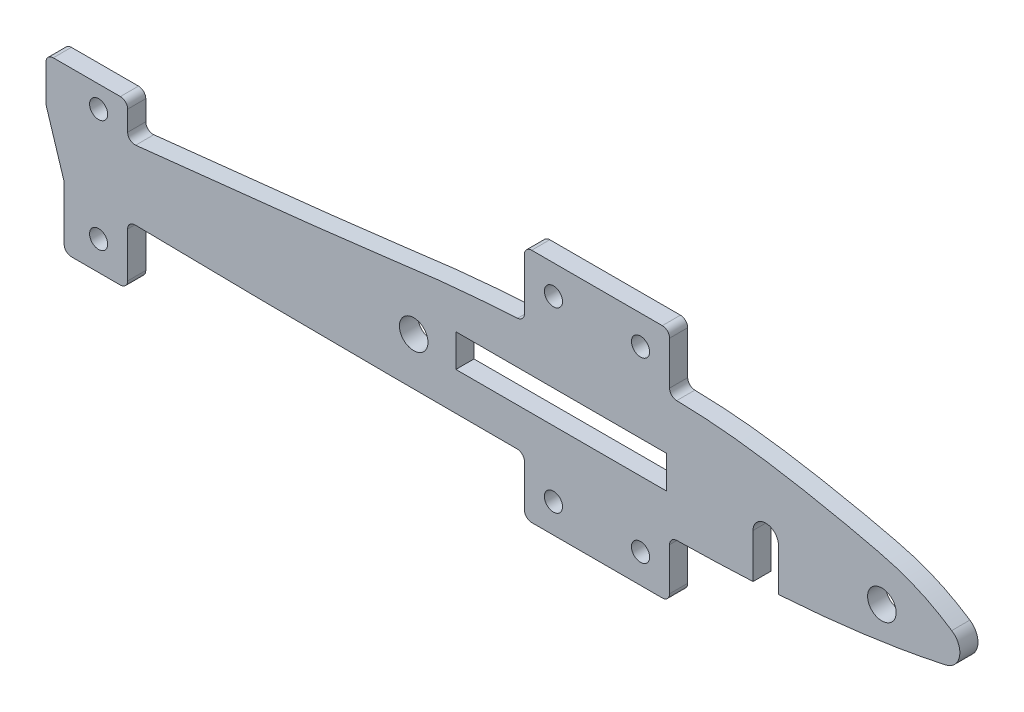
from build123d import *

# Parameters (mm, degrees)
BOSS_EXTRUDE1_DEPTH = 6.35
FILLET1_R           = 6.35
SKETCH2_W           = 50.8
SKETCH2_H           = 6.35
BOSS_EXTRUDE2_DEPTH = 19.05
SKETCH3_W           = 50.8
SKETCH3_H           = 6.35
BOSS_EXTRUDE3_DEPTH = 38.1
SKETCH4_W           = 50.8
SKETCH4_H           = 6.35
BOSS_EXTRUDE4_DEPTH = 63.5
FILLET2_R           = 2.54
SKETCH5_R           = 5
SKETCH5_W           = 73.66
SKETCH5_H           = 11.43
CUT_EXTRUDE3_DEPTH  = 284.408566149
SKETCH6_R           = 3.175
CUT_EXTRUDE4_DEPTH  = 284.408566149
SKETCH8_R           = 3.175
CUT_EXTRUDE5_DEPTH  = 284.408566149
CUT_EXTRUDE6_DEPTH  = 180.280400037


with BuildPart() as part:
    # Sketch1 → Boss-Extrude1 (new body)
    with BuildSketch(Plane.XY):
        with BuildLine():
            add(Edge.make_bspline(
                [(-276.130119323, 8.693130358), (-231.459725957, 13.892182525), (-160.606907467, 22.045765928), (-55.21857633, 32.848239562), (-5.484684229, 39.5878223), (20.294760191, 40.734135472), (52.215253795, 43.311195196), (77.433370096, 43.854837121), (107.657853328, 39.590984865), (131.131357877, 34.766526999), (149.499224412, 30.294140301), (163.418705178, 23.059137739), (171.530279946, 16.921852673), (175.269753602, 13.29140622)],
                knots=[0, 0, 0, 0, 0.247403676, 0.462108507, 0.504395118, 0.627983171, 0.653401948, 0.743134379, 0.818760812, 0.882434425, 0.924179622, 0.96050512, 1, 1, 1, 1], degree=3))
            add(Edge.make_bspline(
                [(-276.130119323, 8.693130358), (-174.260953063, 0.911239157), (-23.669401798, 0.683864032), (127.515095646, 0.681371654), (175.269753602, 13.29140622)],
                knots=[0, 0, 0, 0, 0.67646369, 1, 1, 1, 1], degree=3))
        make_face()
    extrude(amount=BOSS_EXTRUDE1_DEPTH)

    # Fillet1
    fillet1_edges = [part.edges().sort_by_distance(p)[0] for p in [
        (175.269753602, 13.29140622, 3.175),
    ]]
    fillet(fillet1_edges, radius=FILLET1_R)

    # Sketch2 → Boss-Extrude2 (add, symmetric)
    with BuildSketch(Plane(origin=(0, 0, 0), x_dir=(1, 0, 0), z_dir=(0, 1, 0))):
        with Locations((-149.130119323, -3.175)):
            Rectangle(SKETCH2_W, SKETCH2_H)
        with Locations((40.537724966, -3.175)):
            Rectangle(SKETCH2_W, SKETCH2_H)
    extrude(amount=BOSS_EXTRUDE2_DEPTH, both=True)

    # Sketch3 → Boss-Extrude3 (add)
    with BuildSketch(Plane(origin=(0, 0, 0), x_dir=(1, 0, 0), z_dir=(0, 1, 0))):
        with Locations((-149.130119323, -3.175)):
            Rectangle(SKETCH3_W, SKETCH3_H)
    extrude(amount=BOSS_EXTRUDE3_DEPTH)

    # Sketch4 → Boss-Extrude4 (add)
    with BuildSketch(Plane(origin=(0, 0, 0), x_dir=(1, 0, 0), z_dir=(0, 1, 0))):
        with Locations((40.537724966, -3.175)):
            Rectangle(SKETCH4_W, SKETCH4_H)
    extrude(amount=BOSS_EXTRUDE4_DEPTH)

    # Fillet2
    fillet2_edges = [part.edges().sort_by_distance(p)[0] for p in [
        (65.937724966, 0.882409675, 3.175),
        (15.137724966, 0.715325792, 3.175),
        (-123.730119323, 1.809475424, 3.175),
        (-174.530119323, 3.18492072, 3.175),
        (-174.530119323, 20.264304266, 3.175),
        (-123.730119323, 25.734914395, 3.175),
        (15.137724966, 40.575893827, 3.175),
        (65.937724966, 43.322928246, 3.175),
        (65.937724966, -19.05, 3.175),
        (15.137724966, -19.05, 3.175),
        (-174.530119323, -19.05, 3.175),
        (-123.730119323, -19.05, 3.175),
        (-174.530119323, 38.1, 3.175),
        (-123.730119323, 38.1, 3.175),
        (65.937724966, 63.5, 3.175),
        (15.137724966, 63.5, 3.175),
    ]]
    fillet(fillet2_edges, radius=FILLET2_R)

    # Sketch5 → Cut-Extrude3 (cut, through all)
    with BuildSketch(Plane.XY):
        with Locations(Location((140.241842338, 17.410004614, 0), (0, 0, 180))):
            Circle(SKETCH5_R)
        with Locations(Location((-23.613557662, 17.410004614, 0), (0, 0, 180))):
            Circle(SKETCH5_R)
        with Locations((27.973842338, 19.812)):
            Rectangle(SKETCH5_W, SKETCH5_H)
    extrude(amount=CUT_EXTRUDE3_DEPTH, mode=Mode.SUBTRACT)

    # Sketch6 → Cut-Extrude4 (cut, through all)
    with BuildSketch(Plane.XY):
        with Locations(Location((55.777724966, 53.34, 0), (0, 0, 180))):
            Circle(SKETCH6_R)
        with Locations(Location((25.297724966, 53.34, 0), (0, 0, 180))):
            Circle(SKETCH6_R)
        with Locations(Location((55.777724966, -8.89, 0), (0, 0, 180))):
            Circle(SKETCH6_R)
        with Locations(Location((25.297724966, -8.89, 0), (0, 0, 180))):
            Circle(SKETCH6_R)
        with Locations(Location((-133.890119323, 30.48, 0), (0, 0, 180))):
            Circle(SKETCH6_R)
        with Locations(Location((-164.370119323, 30.48, 0), (0, 0, 180))):
            Circle(SKETCH6_R)
        with Locations(Location((-133.890119323, -8.89, 0), (0, 0, 180))):
            Circle(SKETCH6_R)
        with Locations(Location((-164.370119323, -8.89, 0), (0, 0, 180))):
            Circle(SKETCH6_R)
    extrude(amount=CUT_EXTRUDE4_DEPTH, mode=Mode.SUBTRACT)

    # Sketch8 → Cut-Extrude5 (cut, through all)
    with BuildSketch(Plane(origin=(0, 0, 0), x_dir=(-1, 0, 0), z_dir=(0, 0, -1))):
        with BuildLine():
            Line((152.305119323, 35.56), (152.305119323, 22.652979968))
            Line((152.305119323, 22.652979968), (145.955119323, 2.430574079))
            Line((145.955119323, 2.430574079), (145.955119323, -16.51))
            ThreePointArc((145.955119323, -16.51), (145.211170547, -18.306051224), (143.415119323, -19.05))
            Line((143.415119323, -19.05), (171.990119323, -19.05))
            ThreePointArc((171.990119323, -19.05), (173.786170547, -18.306051224), (174.530119323, -16.51))
            Line((174.530119323, -16.51), (174.530119323, 0.732669408))
            add(Edge.make_bspline(
                [(174.530119323, 0.732669408), (174.530119323, 0.827098892), (174.534332017, 0.922829058), (174.542975148, 1.019550557), (174.556231365, 1.116913443), (174.574237139, 1.214535389), (174.647171539, 1.525872583), (174.720530405, 1.739086636), (174.817987929, 1.947258959), (174.939041393, 2.145669731), (175.081636695, 2.329900504), (175.40320955, 2.663115508), (175.582254784, 2.812169869), (175.77623684, 2.94020009), (175.980813085, 3.044996297), (176.191284552, 3.125888304), (176.499832231, 3.209844277), (176.59675239, 3.231309016), (176.693582493, 3.24801799), (176.789935606, 3.260093994), (176.885455508, 3.26770712), (176.979825307, 3.271063977)],
                knots=[0, 0, 0, 0, 0, 0, 0, 0.156541714, 0.156541714, 0.156541714, 0.156541714, 0.156541714, 0.5, 0.5, 0.5, 0.5, 0.5, 0.843458286, 0.843458286, 0.843458286, 0.843458286, 0.843458286, 1, 1, 1, 1, 1, 1, 1], degree=6))
            add(Edge.make_bspline(
                [(276.130119323, 8.693130358), (243.083160763, 6.168638939), (210.036144296, 4.446920485), (176.979825307, 3.271063977)],
                knots=[0, 0, 0, 0, 0.219448812, 0.219448812, 0.219448812, 0.219448812], degree=3))
            add(Edge.make_bspline(
                [(276.130119323, 8.693130358), (241.143309206, 12.765139518), (210.289343773, 16.325674302), (176.792020475, 20.015402476)],
                knots=[0, 0, 0, 0, 0.193771865, 0.193771865, 0.193771865, 0.193771865], degree=3))
            add(Edge.make_bspline(
                [(176.792020475, 20.015402476), (176.702534659, 20.025259334), (176.612334841, 20.039047045), (176.521708613, 20.056916996), (176.430972739, 20.078987549), (176.340465644, 20.105336292), (176.052123832, 20.203632982), (175.856494206, 20.292258021), (175.667511078, 20.402173666), (175.489198081, 20.532546831), (175.325208173, 20.681273314), (175.070618463, 20.965445878), (174.972096017, 21.093854031), (174.883813086, 21.22927413), (174.806550855, 21.370274525), (174.740735934, 21.515302785), (174.633101241, 21.807741296), (174.590880763, 21.955079167), (174.559863739, 22.103342362), (174.539790441, 22.251097449), (174.530119323, 22.397057265), (174.530119323, 22.540132369)],
                knots=[0, 0, 0, 0, 0, 0, 0, 0.155935083, 0.155935083, 0.155935083, 0.155935083, 0.155935083, 0.499997058, 0.499997058, 0.499997058, 0.499997058, 0.499997058, 0.752183878, 0.752183878, 0.752183878, 0.752183878, 0.752183878, 1, 1, 1, 1, 1, 1, 1], degree=6))
            Line((174.530119323, 22.540132369), (174.530119323, 35.56))
            ThreePointArc((174.530119323, 35.56), (173.786170547, 37.356051224), (171.990119323, 38.1))
            Line((171.990119323, 38.1), (149.765119323, 38.1))
            ThreePointArc((149.765119323, 38.1), (151.561170547, 37.356051224), (152.305119323, 35.56))
        make_face()
        with Locations((164.370119323, -8.89)):
            Circle(SKETCH8_R, mode=Mode.SUBTRACT)
        with Locations((164.370119323, 30.48)):
            Circle(SKETCH8_R, mode=Mode.SUBTRACT)
    extrude(amount=-CUT_EXTRUDE5_DEPTH, mode=Mode.SUBTRACT)

    # Sketch10 → Cut-Extrude6 (cut, through all)
    with BuildSketch(Plane(origin=(0, 0, 0), x_dir=(-1, 0, 0), z_dir=(0, 0, -1))):
        with BuildLine():
            Line((-95.157002323, 17.295971295), (-95.157002323, 1.810619129))
            add(Edge.make_bspline(
                [(-95.157002323, 1.810619129), (-98.122222912, 1.963522837), (-101.08564833, 2.137394625), (-104.047002323, 2.335082223)],
                knots=[0.821015806, 0.821015806, 0.821015806, 0.821015806, 0.840729968, 0.840729968, 0.840729968, 0.840729968], degree=3))
            Line((-104.047002323, 2.335082223), (-104.047002323, 17.295971295))
            ThreePointArc((-104.047002323, 17.295971295), (-99.602002323, 21.740971295), (-95.157002323, 17.295971295))
        make_face()
    extrude(amount=-CUT_EXTRUDE6_DEPTH, mode=Mode.SUBTRACT)


solid = part.part
